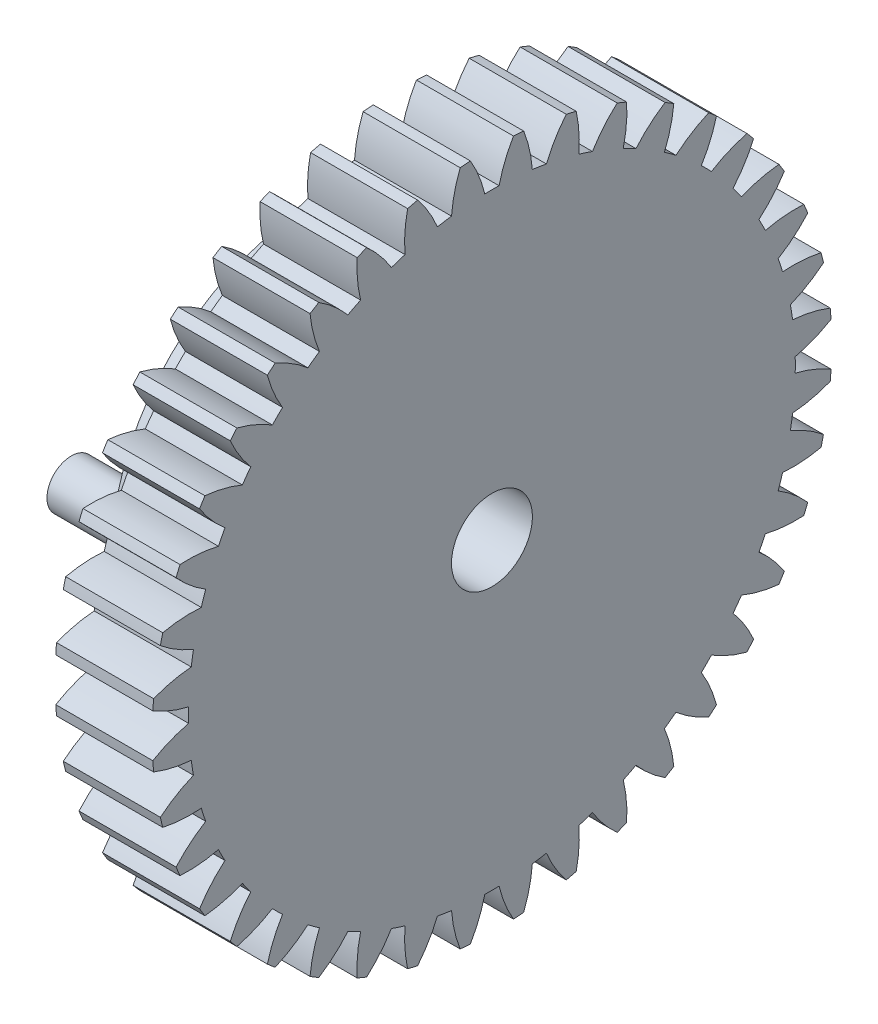
from build123d import *
from build123d.topology import SkipClean

# Parameters (mm, degrees)
BASPROSKE_W         = 12
BASPROSKE_H         = 42
TOOTHCUT_DEPTH      = 61.59702963
TEETHCUTS_COUNT     = 40
TEETHCUTS_ANGLE     = 351
BORSKE_R            = 5
BORE_DEPTH          = 50.0000508
SKETCH1_R           = 25
SKETCH1_R_2         = 5
SKETCH1_R_3         = 3
BOSS_EXTRUDE1_DEPTH = 10
SKETCH1_2_R         = 3
BOSS_EXTRUDE2_DEPTH = 20
SKETCH1_3_R         = 3
BOSS_EXTRUDE3_DEPTH = 20


with BuildPart() as part:
    # BasProSke → Base-Revolve (revolve)
    with BuildSketch(Plane(origin=(0, 0, 0), x_dir=(1, 0, 0), z_dir=(0, 1, 0))):
        with Locations((6, 21)):
            Rectangle(BASPROSKE_W, BASPROSKE_H)
    revolve(axis=Axis((-10, 0, 0), (1, 0, 0)))

    # TooCutSke → ToothCut (cut, through all)
    with BuildSketch(Plane(origin=(0, 0, 0), x_dir=(0, 0, -1), z_dir=(1, 0, 0))):
        with BuildLine():
            ThreePointArc((0.882812088, 37.488606854), (0, 37.499), (-0.882812088, 37.488606854))
            ThreePointArc((-0.882812088, 37.488606854), (-1.612748684, 39.782000434), (-2.678427154, 41.939960338))
            ThreePointArc((-2.678427154, 41.939960338), (0, 42.0254), (2.678427154, 41.939960338))
            ThreePointArc((2.678427154, 41.939960338), (1.612748684, 39.782000434), (0.882812088, 37.488606854))
        make_face()
    toothcut = extrude(amount=TOOTHCUT_DEPTH, mode=Mode.SUBTRACT)

    # TeethCuts: ToothCut ×40 about axis
    teethcuts_axis = Axis((-10, 0, 0), (1, 0, 0))
    for i in range(1, TEETHCUTS_COUNT):
        add(toothcut.rotate(teethcuts_axis, i * TEETHCUTS_ANGLE / (TEETHCUTS_COUNT - 1)), mode=Mode.SUBTRACT)

    # BorSke → Bore (cut, symmetric)
    with BuildSketch(Plane(origin=(0, 0, 0), x_dir=(0, 0, -1), z_dir=(1, 0, 0))):
        Circle(BORSKE_R)
    extrude(amount=BORE_DEPTH, both=True, mode=Mode.SUBTRACT)

    # Sketch1 → Boss-Extrude1 (add)
    with SkipClean():  # the faces are left unmerged after this step: merging them gives an invalid solid
        with BuildSketch(Plane.ZY):
            Circle(SKETCH1_R)
            Circle(SKETCH1_R_2, mode=Mode.SUBTRACT)
            with Locations((20, 0)):
                Circle(SKETCH1_R_3, mode=Mode.SUBTRACT)
            with Locations((-20, 0)):
                Circle(SKETCH1_R_3, mode=Mode.SUBTRACT)
        extrude(amount=BOSS_EXTRUDE1_DEPTH)


with BuildPart() as body_2:
    # Sketch1<2> → Boss-Extrude2 (new body)
    with BuildSketch(Plane.ZY):
        with Locations((-20, 0)):
            Circle(SKETCH1_2_R)
    extrude(amount=BOSS_EXTRUDE2_DEPTH)


with BuildPart() as body_3:
    # Sketch1<3> → Boss-Extrude3 (new body)
    with BuildSketch(Plane.ZY):
        with Locations((20, 0)):
            Circle(SKETCH1_3_R)
    extrude(amount=BOSS_EXTRUDE3_DEPTH)


solid = Compound([part.part, body_2.part, body_3.part])
